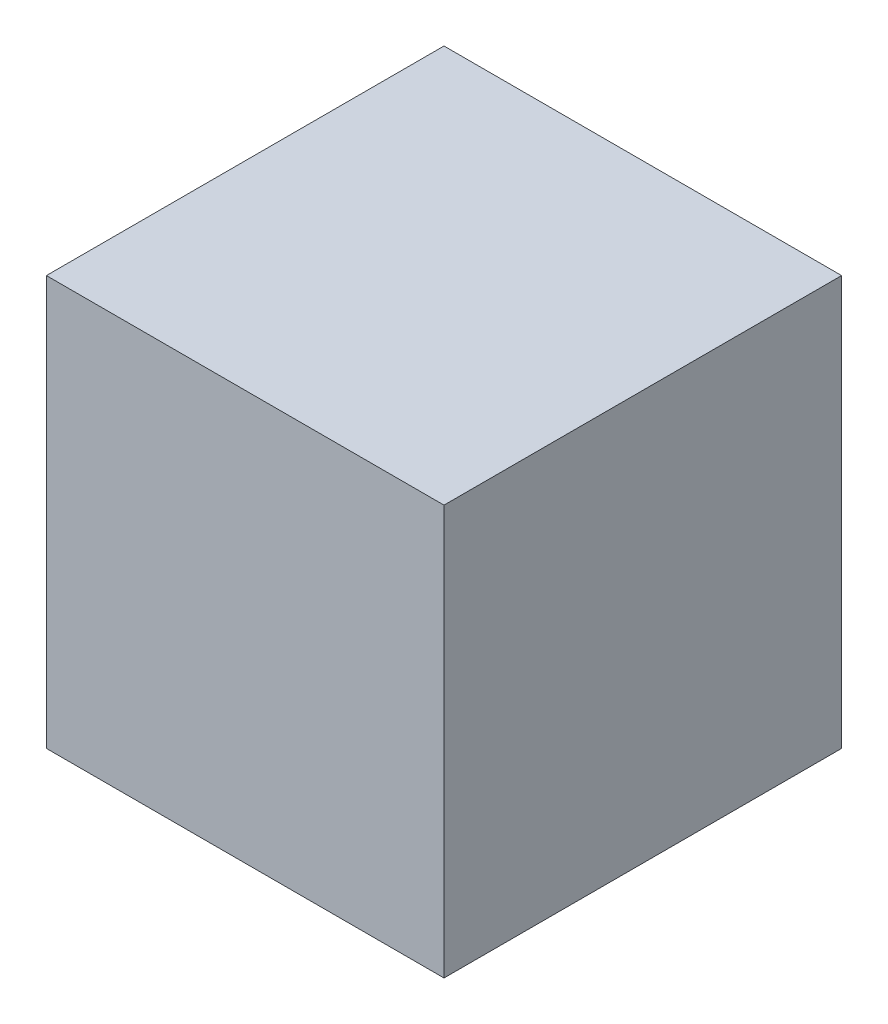
from build123d import *

# Parameters (mm, degrees)
SKETCH_1_W      = 100
SKETCH_1_H      = 100
EXTRUDE_1_DEPTH = 3
SKETCH_2_W      = 100
SKETCH_2_H      = 100
SKETCH_2_W_2    = 94
SKETCH_2_H_2    = 94
EXTRUDE_2_DEPTH = 100


with BuildPart() as part:
    # 草图1 → 凸台-拉伸1 (new body)
    with BuildSketch(Plane(origin=(0, 0, 0), x_dir=(1, 0, 0), z_dir=(0, 1, 0))):
        Rectangle(SKETCH_1_W, SKETCH_1_H)
    extrude(amount=EXTRUDE_1_DEPTH)

    # 草图2 → 凸台-拉伸2 (add)
    with BuildSketch(Plane.XZ):
        Rectangle(SKETCH_2_W, SKETCH_2_H)
        Rectangle(SKETCH_2_W_2, SKETCH_2_H_2, mode=Mode.SUBTRACT)
    extrude(amount=EXTRUDE_2_DEPTH)


solid = part.part
